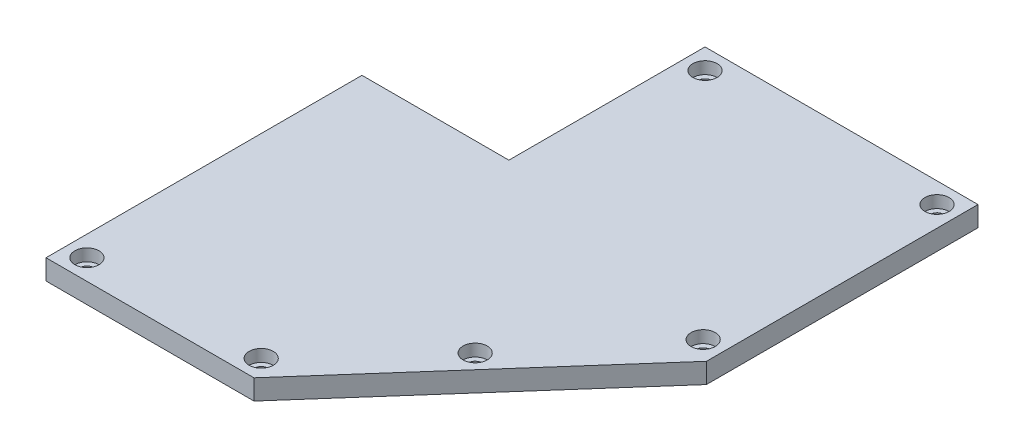
from build123d import *

# Parameters (mm, degrees)
BOSS_EXTRUDE1_DEPTH   = 5
F_4_0MM_DOWEL_HOLE1_D = 3.5
SKETCH4_R             = 3
CUT_EXTRUDE1_DEPTH    = 3


with BuildPart() as part:
    # Sketch1 → Boss-Extrude1 (new body)
    with BuildSketch(Plane(origin=(0, 0, 0), x_dir=(1, 0, 0), z_dir=(0, 1, 0))):
        Polygon((0, 0), (-67.7, 0), (-67.7, -48.64), (-104.14, -48.64), (-104.140084457, -126.999681711), (-52.560084457, -126.999681711), (0, -67.34), align=None)
    extrude(amount=BOSS_EXTRUDE1_DEPTH)

    # Ø4.0mm Dowel Hole1 (through all)
    with Locations(Plane(origin=(-99.060084457, 5, 121.919681711), x_dir=(0, 0, 1), z_dir=(0, 1, 0))):
        with Locations((0, 0), (0, 43.21), (-58.839681711, 93.980084457), (-27.682634748, 68.593581655), (-116.839681711, 93.980084457), (-116.839681711, 36.440084457)):
            Hole(F_4_0MM_DOWEL_HOLE1_D / 2)

    # Sketch4 → Cut-Extrude1 (cut)
    with BuildSketch(Plane(origin=(0, 5, 0), x_dir=(1, 0, 0), z_dir=(0, 1, 0))):
        with Locations(Location((-99.060084457, -121.919681711, 0), (0, 0, 270))):
            Circle(SKETCH4_R)
        with Locations(Location((-55.850084457, -121.919681711, 0), (0, 0, 270))):
            Circle(SKETCH4_R)
        with Locations(Location((-30.466502802, -94.237046963, 0), (0, 0, 270))):
            Circle(SKETCH4_R)
        with Locations(Location((-5.08, -63.08, 0), (0, 0, 270))):
            Circle(SKETCH4_R)
        with Locations(Location((-5.08, -5.08, 0), (0, 0, 270))):
            Circle(SKETCH4_R)
        with Locations(Location((-62.62, -5.08, 0), (0, 0, 270))):
            Circle(SKETCH4_R)
    extrude(amount=-CUT_EXTRUDE1_DEPTH, mode=Mode.SUBTRACT)


solid = part.part
